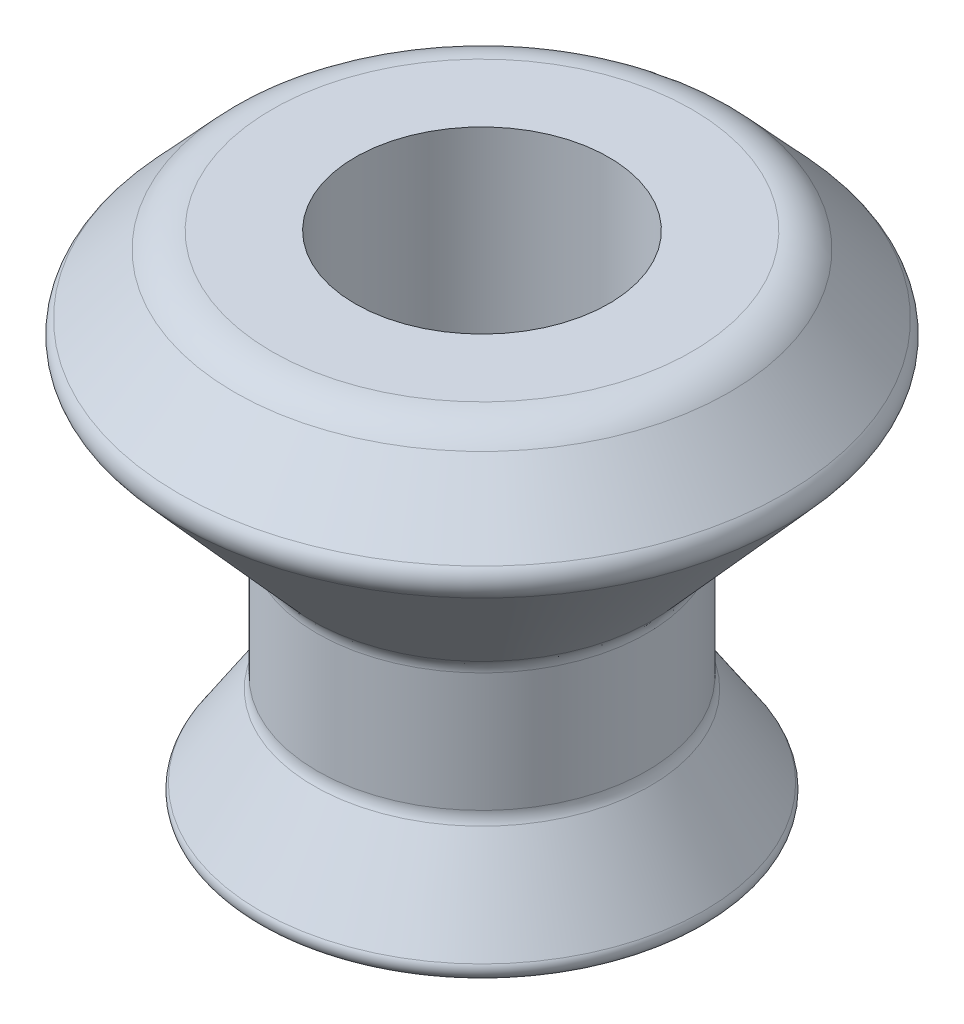
from build123d import *

# Parameters (mm, degrees)
SKETCH2_R          = 3.1496
SKETCH2_R_2        = 2.0066
CUT_EXTRUDE1_DEPTH = 9.652
SKETCH2_2_R        = 2.0066
CUT_EXTRUDE2_DEPTH = 17.363717474


with BuildPart() as part:
    # Sketch1 → Revolve1 (revolve)
    with BuildSketch(Plane.XY):
        with BuildLine():
            Line((0, 0), (5.293826023, 0))
            ThreePointArc((5.293826023, 0), (5.517493338, 0.13363002), (5.505816812, 0.393913921))
            Line((5.505816812, 0.393913921), (4.173418421, 2.412699361))
            ThreePointArc((4.173418421, 2.412699361), (4.110857791, 2.54644271), (4.0894, 2.692527203))
            Line((4.0894, 2.692527203), (4.0894, 5.648040158))
            ThreePointArc((4.0894, 5.648040158), (4.122815879, 5.82924146), (4.218667369, 5.986604176))
            Line((4.218667369, 5.986604176), (7.527837593, 9.688387816))
            ThreePointArc((7.527837593, 9.688387816), (7.657085265, 10.031425293), (7.521816282, 10.37213334))
            Line((7.521816282, 10.37213334), (6.142780319, 11.861153766))
            ThreePointArc((6.142780319, 11.861153766), (5.719405756, 12.161997938), (5.21100202, 12.2682))
            Line((5.21100202, 12.2682), (0, 12.2682))
            Line((0, 12.2682), (0, 0))
        make_face()
    revolve(axis=Axis((0, 0, 0), (0, 1, 0)))

    # Sketch2 → Cut-Extrude1 (cut)
    with BuildSketch(Plane(origin=(0, 12.2682, 0), x_dir=(1, 0, 0), z_dir=(0, 1, 0))):
        Circle(SKETCH2_R)
        Circle(SKETCH2_R_2, mode=Mode.SUBTRACT)
    extrude(amount=-CUT_EXTRUDE1_DEPTH, mode=Mode.SUBTRACT)

    # Sketch2<2> → Cut-Extrude2 (cut, through all)
    with BuildSketch(Plane(origin=(0, 12.2682, 0), x_dir=(1, 0, 0), z_dir=(0, 1, 0))):
        Circle(SKETCH2_2_R)
    extrude(amount=-CUT_EXTRUDE2_DEPTH, mode=Mode.SUBTRACT)


solid = part.part
